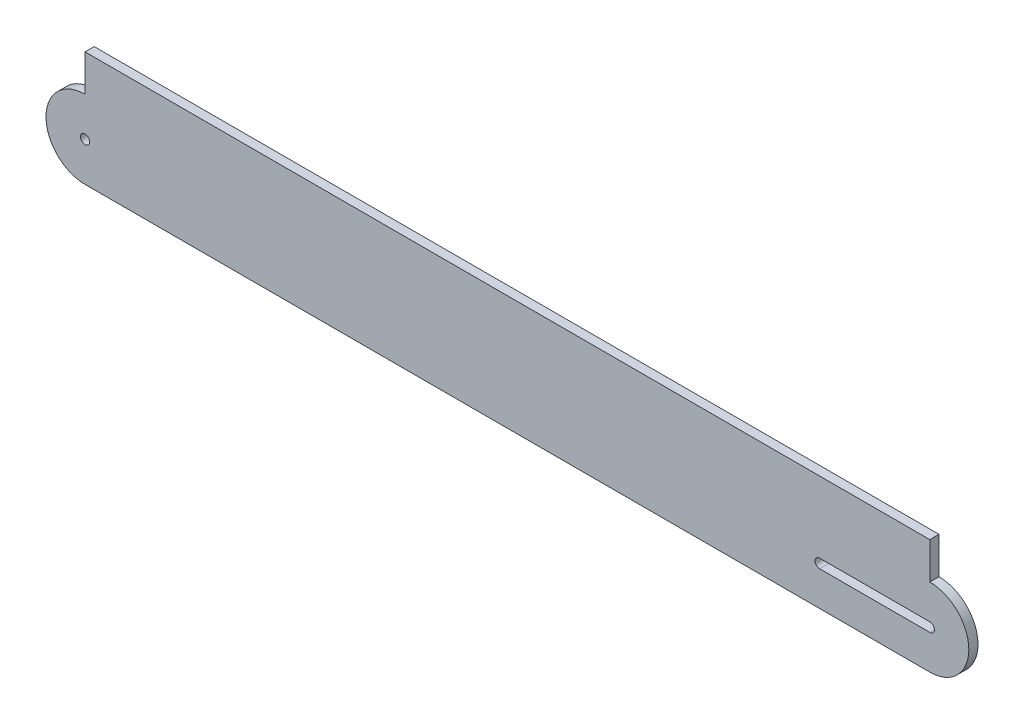
from build123d import *

# Parameters (mm, degrees)
SKETCH1_W           = 584.2
SKETCH1_H           = 25.4
BOSS_EXTRUDE1_DEPTH = 3.175
SKETCH2_R           = 3.175
CUT_EXTRUDE1_DEPTH  = 614.461435473


with BuildPart() as part:
    # Sketch1 → Boss-Extrude1 (new, symmetric)
    with BuildSketch(Plane.XY):
        with Locations((292.1, 39.6875)):
            Rectangle(SKETCH1_W, SKETCH1_H)
        with BuildLine():
            Line((0, -26.9875), (584.2, -26.9875))
            ThreePointArc((584.2, -26.9875), (611.1875, 0), (584.2, 26.9875))
            Line((584.2, 26.9875), (0, 26.9875))
            ThreePointArc((0, 26.9875), (-26.9875, 0), (0, -26.9875))
        make_face()
    extrude(amount=BOSS_EXTRUDE1_DEPTH, both=True)

    # Sketch2 → Cut-Extrude1 (cut, through all)
    with BuildSketch(Plane.XY.offset(3.175)):
        Circle(SKETCH2_R)
        with BuildLine():
            Line((508, 3.175), (584.2, 3.175))
            ThreePointArc((584.2, 3.175), (587.375, 0), (584.2, -3.175))
            Line((584.2, -3.175), (508, -3.175))
            ThreePointArc((508, -3.175), (504.825, 0), (508, 3.175))
        make_face()
    extrude(amount=-CUT_EXTRUDE1_DEPTH, mode=Mode.SUBTRACT)


solid = part.part
